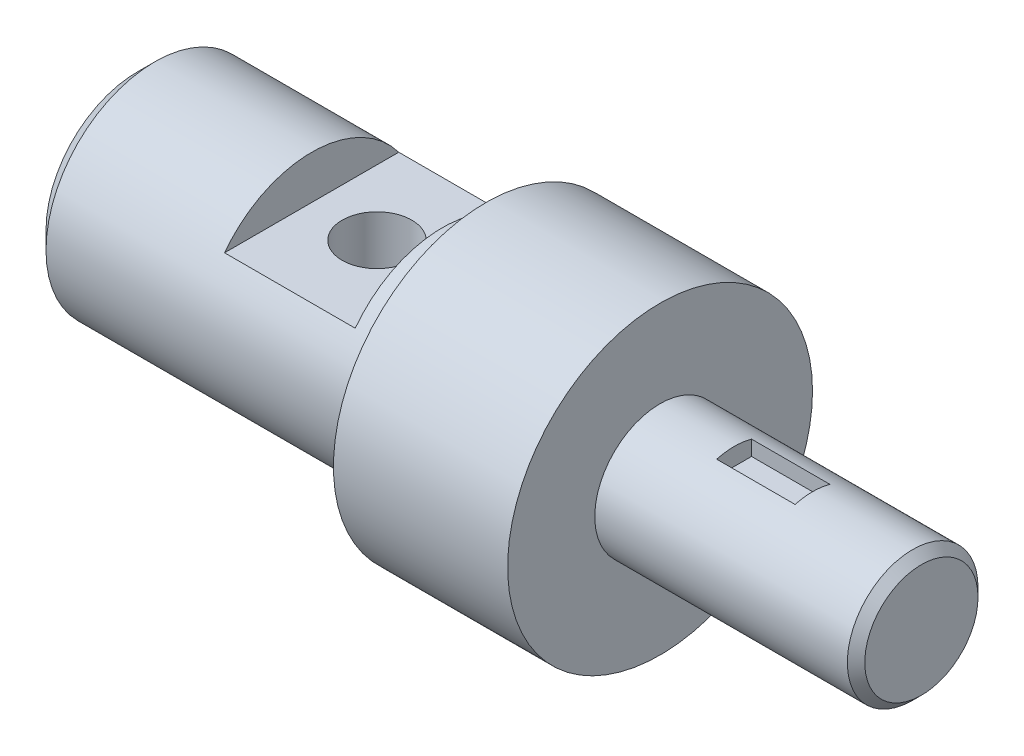
from build123d import *

# Parameters (mm, degrees)
CUT_EXTRUDE_7_DEPTH      = 187.681547026
CUT_EXTRUDE_7_DEPTH_BACK = 187.681547026
SKETCH_10_W              = 30
SKETCH_10_H              = 10
SKETCH_14_R              = 8
CUT_EXTRUDE_8_DEPTH      = 191.065778087
SKETCH_6_W               = 18
SKETCH_6_H               = 4
CUT_EXTRUDE_4_DEPTH      = 4
CHAMFER_3_SIZE           = 2
CHAMFER_4_SIZE           = 4


with BuildPart() as part:
    # Эскиз1 → Повернуть1 (revolve)
    with BuildSketch(Plane.XY, mode=Mode.PRIVATE) as revolve_1_sk:
        Polygon((0, 0), (0, 25), (80, 25), (80, 35), (120, 35), (120, 15), (180, 15), (180, 0), align=None)
    revolve(revolve_1_sk.sketch.rotate(Axis((0, 0, 0), (-1, 0, 0)), 90), axis=Axis((0, 0, 0), (-1, 0, 0)))

    # Эскиз10 → Вырез-Вытянуть7 (cut, two sides: drawn at the far end of the back side and taken through both)
    with BuildSketch(Plane.XY.offset(-CUT_EXTRUDE_7_DEPTH_BACK)):
        with Locations((55, 20)):
            Rectangle(SKETCH_10_W, SKETCH_10_H)
    extrude(amount=CUT_EXTRUDE_7_DEPTH + CUT_EXTRUDE_7_DEPTH_BACK, mode=Mode.SUBTRACT)

    # Эскиз14 → Вырез-Вытянуть8 (cut, through all)
    with BuildSketch(Plane(origin=(0, 15, 0), x_dir=(1, 0, 0), z_dir=(0, 1, 0))):
        with Locations(Location((55, 0, 0), (0, 0, 270))):
            Circle(SKETCH_14_R)
    extrude(amount=-CUT_EXTRUDE_8_DEPTH, mode=Mode.SUBTRACT)

    # Эскиз6 → Вырез-Вытянуть4 (cut, symmetric)
    with BuildSketch(Plane.XY):
        with Locations((146, 13)):
            Rectangle(SKETCH_6_W, SKETCH_6_H)
    extrude(amount=CUT_EXTRUDE_4_DEPTH, both=True, mode=Mode.SUBTRACT)

    # Фаска3
    chamfer_3_edges = [part.edges().sort_by_distance(p)[0] for p in [
        (180, 0, 15),
    ]]
    chamfer(chamfer_3_edges, length=CHAMFER_3_SIZE)

    # Фаска4
    chamfer_4_edges = [part.edges().sort_by_distance(p)[0] for p in [
        (0, 0, 25),
    ]]
    chamfer(chamfer_4_edges, length=CHAMFER_4_SIZE)


solid = part.part
